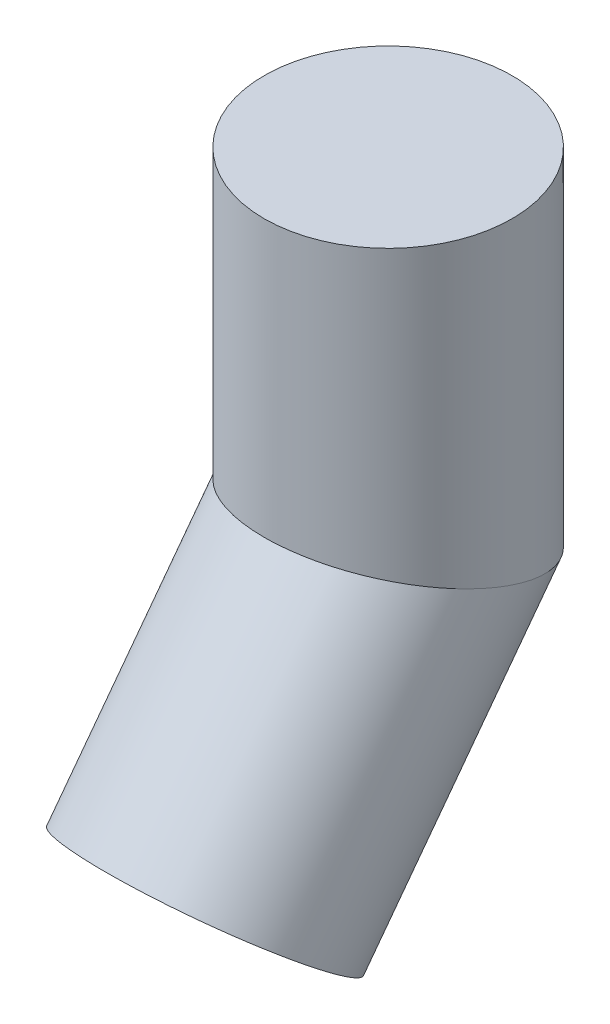
from build123d import *

# Parameters (mm, degrees)
CROQUIS1_R              = 101.6
SALIENTE_EXTRUIR1_DEPTH = 10
CROQUIS2_R              = 101.6


with BuildPart() as part:
    # Croquis1 → Saliente-Extruir1 (new body)
    with BuildSketch(Plane(origin=(0, 0, 0), x_dir=(1, 0, 0), z_dir=(0, 1, 0))):
        with Locations(Location((0, 0, 0), (0, 0, 270))):
            Circle(CROQUIS1_R)
    extrude(amount=-SALIENTE_EXTRUIR1_DEPTH)

    # Barrer1: sweep along a curve in space
    with BuildLine() as barrer1_path:
        Line((0, -10, 0), (0, -260, 0))
        Line((0, -460, 150), (0, -260, 0))
    # Croquis2 → Barrer1 (sweep)
    with BuildSketch(Plane.XZ.offset(10)):
        Circle(CROQUIS2_R)
    sweep(path=barrer1_path.line, transition=Transition.RIGHT)


solid = part.part
